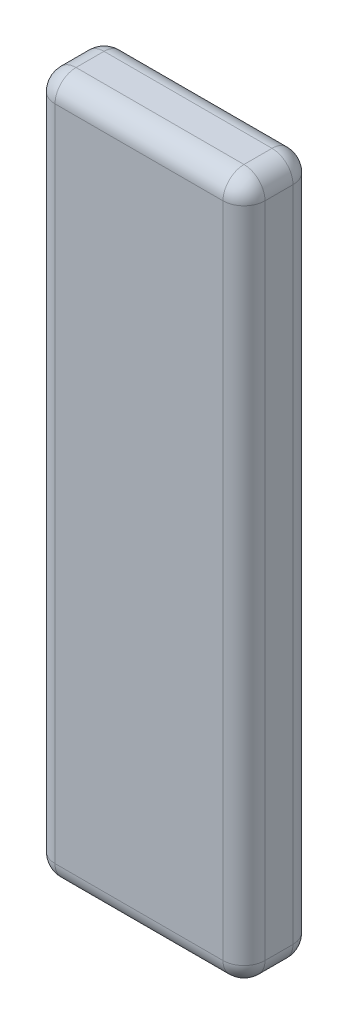
from build123d import *

# Parameters (mm, degrees)
SKIZZE1_W                       = 6
SKIZZE1_H                       = 20
AUFSATZ_LINEAR_AUSTRAGEN1_DEPTH = 2
VERRUNDUNG1_R                   = 0.6


with BuildPart() as part:
    # Skizze1 → Aufsatz-Linear austragen1 (new body)
    with BuildSketch(Plane.XY):
        with Locations((3, -10)):
            Rectangle(SKIZZE1_W, SKIZZE1_H)
    extrude(amount=AUFSATZ_LINEAR_AUSTRAGEN1_DEPTH)

    # Verrundung1
    verrundung1_edges = [part.edges().sort_by_distance(p)[0] for p in [
        (6, -10, 2),
        (3, 0, 2),
        (0, -10, 2),
        (3, 0, 0),
        (6, -10, 0),
        (3, -20, 0),
        (0, -10, 0),
        (0, 0, 1),
        (6, 0, 1),
        (6, -20, 1),
        (0, -20, 1),
        (3, -20, 2),
    ]]
    fillet(verrundung1_edges, radius=VERRUNDUNG1_R)


solid = part.part
